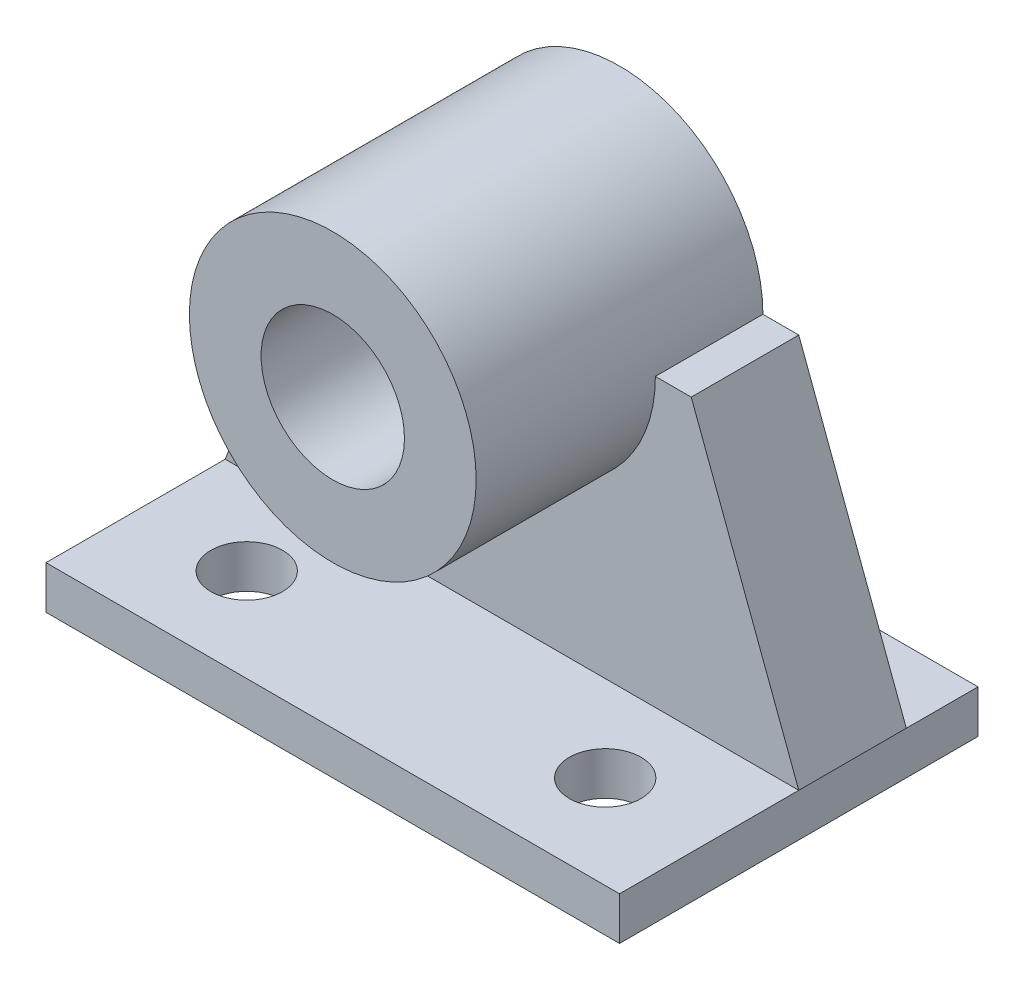
from build123d import *

# Parameters (mm, degrees)
SKETCH1_W           = 80
SKETCH1_H           = 6
BOSS_EXTRUDE1_DEPTH = 50
SKETCH6_R           = 20
BOSS_EXTRUDE2_DEPTH = 15
BOSS_EXTRUDE3_START = 25
SKETCH7_R           = 20
BOSS_EXTRUDE3_DEPTH = 25
CUT_EXTRUDE1_REACH  = 90.639
SKETCH8_R           = 10
CUT_EXTRUDE2_REACH  = 79.342
SKETCH9_R           = 5


with BuildPart() as part:
    # Sketch1 → Boss-Extrude1 (new body)
    with BuildSketch(Plane.XY):
        with Locations((1.914357683, -3)):
            Rectangle(SKETCH1_W, SKETCH1_H)
    extrude(amount=-BOSS_EXTRUDE1_DEPTH)


with BuildPart() as part_1:
    # Body-Move/Copy2: moved
    add(part.part.moved(Location((0, 0, 25))))

    # Sketch6 → Boss-Extrude2 (add)
    with BuildSketch(Plane.XY):
        with BuildLine():
            Line((-38.085642317, 0), (41.914357683, 0))
            Line((41.914357683, 0), (26.914357683, 40))
            Line((26.914357683, 40), (21.914357683, 40))
            ThreePointArc((21.914357683, 40), (1.914357683, 20), (-18.085642317, 40))
            Line((-18.085642317, 40), (-23.085642317, 40))
            Line((-23.085642317, 40), (-38.085642317, 0))
        make_face()
        with Locations((1.914357683, 40)):
            Circle(SKETCH6_R)
    extrude(amount=-BOSS_EXTRUDE2_DEPTH)

    # Sketch7 → Boss-Extrude3 (add)
    with BuildSketch(Plane.XY.offset(BOSS_EXTRUDE3_START)):
        with Locations((1.914357683, 40)):
            Circle(SKETCH7_R)
    extrude(amount=-BOSS_EXTRUDE3_DEPTH)

    # Sketch8 → Cut-Extrude1 (cut, up to next)
    with BuildSketch(Plane.XY.offset(25), mode=Mode.PRIVATE) as cut_extrude1_sk1:
        with Locations((1.914357683, 40)):
            Circle(SKETCH8_R)
    cut_extrude1_tool1 = extrude(cut_extrude1_sk1.sketch, amount=-CUT_EXTRUDE1_REACH, mode=Mode.PRIVATE) & part_1.part
    add(cut_extrude1_tool1.solids().sort_by_distance((1.914358, 40, 25))[0], mode=Mode.SUBTRACT)

    # Sketch9 → Cut-Extrude2 (cut, up to next)
    with BuildSketch(Plane(origin=(0, 0, 0), x_dir=(1, 0, 0), z_dir=(0, 1, 0)), mode=Mode.PRIVATE) as cut_extrude2_sk1:
        with Locations(Location((26.914357683, -12, 0), (0, 0, 270))):
            Circle(SKETCH9_R)
    cut_extrude2_tool1 = extrude(cut_extrude2_sk1.sketch, amount=-CUT_EXTRUDE2_REACH, mode=Mode.PRIVATE) & part_1.part
    # Sketch9 → Cut-Extrude2 (cut, up to next)
    with BuildSketch(Plane(origin=(0, 0, 0), x_dir=(1, 0, 0), z_dir=(0, 1, 0)), mode=Mode.PRIVATE) as cut_extrude2_sk2:
        with Locations(Location((-23.085642317, -12, 0), (0, 0, 270))):
            Circle(SKETCH9_R)
    cut_extrude2_tool2 = extrude(cut_extrude2_sk2.sketch, amount=-CUT_EXTRUDE2_REACH, mode=Mode.PRIVATE) & part_1.part
    add(cut_extrude2_tool1.solids().sort_by_distance((26.914358, 0, 12))[0], mode=Mode.SUBTRACT)
    add(cut_extrude2_tool2.solids().sort_by_distance((-23.085642, 0, 12))[0], mode=Mode.SUBTRACT)


solid = part_1.part
